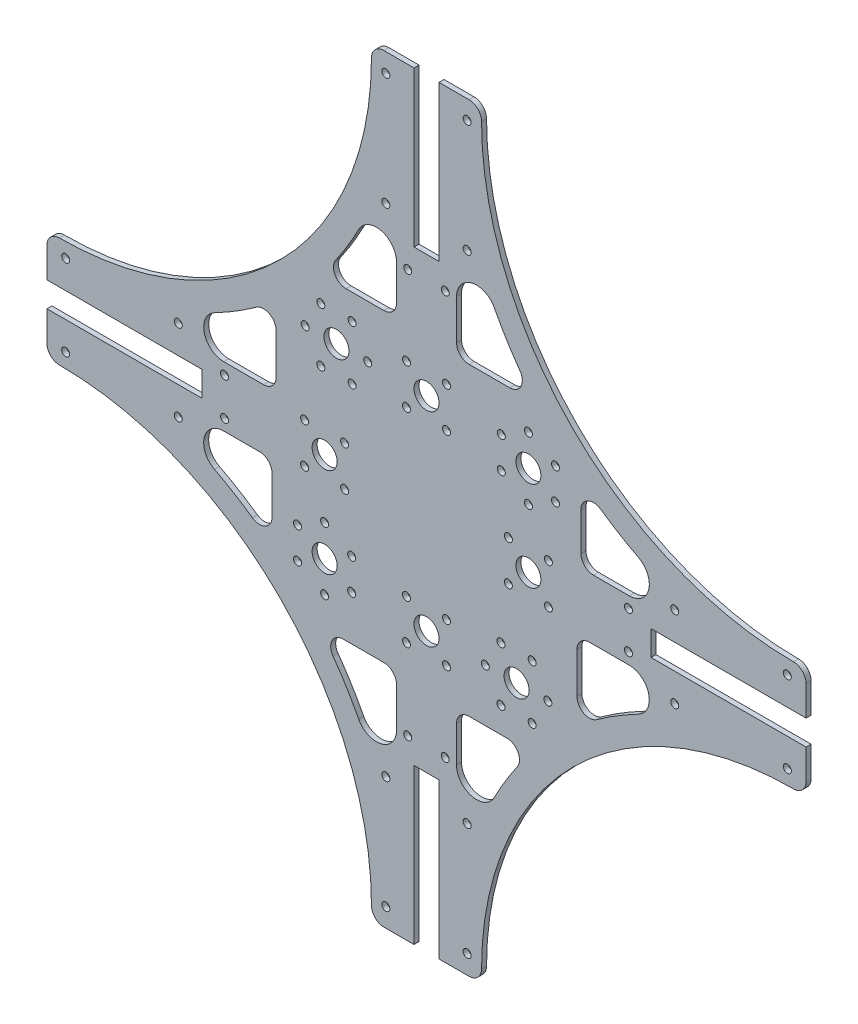
from build123d import *

# Parameters (mm, degrees)
BOSS_EXTRUDE1_DEPTH = 2
SKETCH2_R           = 5
CUT_EXTRUDE1_DEPTH  = 2
SKETCH3_R           = 5
SKETCH3_R_2         = 1.6
CUT_EXTRUDE2_DEPTH  = 2
SKETCH4_W           = 62
SKETCH4_H           = 10
CUT_EXTRUDE3_DEPTH  = 2
CIRPATTERN1_COUNT   = 4
BOSS_EXTRUDE2_DEPTH = 2
CIRPATTERN2_COUNT   = 4
SKETCH6_R           = 1.6
CUT_EXTRUDE4_DEPTH  = 2
CIRPATTERN3_COUNT   = 4
SKETCH7_R           = 1.6
CUT_EXTRUDE5_DEPTH  = 2
CIRPATTERN4_COUNT   = 4


with BuildPart() as part:
    # Sketch1 → Boss-Extrude1 (new body)
    with BuildSketch(Plane.XY):
        with BuildLine():
            Line((71.228993619, -85.582665129), (71.228993619, -51.582665129))
            ThreePointArc((71.228993619, -51.582665129), (69.764527525, -48.047131224), (66.228993619, -46.582665129))
            Line((66.228993619, -46.582665129), (-5.667209242, -46.582665129))
            ThreePointArc((-5.667209242, -46.582665129), (-25.346028045, -13.428336197), (-58.500356977, 6.250482606))
            Line((-58.500356977, 6.250482606), (-58.500356977, 78.146685467))
            ThreePointArc((-58.500356977, 78.146685467), (-59.964823071, 81.682219373), (-63.500356977, 83.146685467))
            Line((-63.500356977, 83.146685467), (-97.500356977, 83.146685467))
            ThreePointArc((-97.500356977, 83.146685467), (-101.035890883, 81.682219373), (-102.500356977, 78.146685467))
            Line((-102.500356977, 78.146685467), (-102.500356977, 6.250482606))
            ThreePointArc((-102.500356977, 6.250482606), (-135.65468591, -13.428336197), (-155.333504713, -46.582665129))
            Line((-155.333504713, -46.582665129), (-227.229707574, -46.582665129))
            ThreePointArc((-227.229707574, -46.582665129), (-230.76524148, -48.047131224), (-232.229707574, -51.582665129))
            Line((-232.229707574, -51.582665129), (-232.229707574, -85.582665129))
            ThreePointArc((-232.229707574, -85.582665129), (-230.76524148, -89.118199035), (-227.229707574, -90.582665129))
            Line((-227.229707574, -90.582665129), (-155.333504713, -90.582665129))
            ThreePointArc((-155.333504713, -90.582665129), (-135.65468591, -123.736994062), (-102.500356977, -143.415812865))
            Line((-102.500356977, -143.415812865), (-102.500356977, -215.312015726))
            ThreePointArc((-102.500356977, -215.312015726), (-101.035890883, -218.847549632), (-97.500356977, -220.312015726))
            Line((-97.500356977, -220.312015726), (-63.500356977, -220.312015726))
            ThreePointArc((-63.500356977, -220.312015726), (-59.964823071, -218.847549632), (-58.500356977, -215.312015726))
            Line((-58.500356977, -215.312015726), (-58.500356977, -143.415812865))
            ThreePointArc((-58.500356977, -143.415812865), (-25.346028045, -123.736994062), (-5.667209242, -90.582665129))
            Line((-5.667209242, -90.582665129), (66.228993619, -90.582665129))
            ThreePointArc((66.228993619, -90.582665129), (69.764527525, -89.118199035), (71.228993619, -85.582665129))
        make_face()
    extrude(amount=BOSS_EXTRUDE1_DEPTH)

    # Sketch2 → Cut-Extrude1 (cut)
    with BuildSketch(Plane.XY.offset(2)):
        with Locations((-39.771006381, -68.582665129)):
            Circle(SKETCH2_R)
        with Locations((-80.500356977, -109.312015726)):
            Circle(SKETCH2_R)
        with Locations((-121.229707574, -68.582665129)):
            Circle(SKETCH2_R)
        with Locations((-80.500356977, -27.853314533)):
            Circle(SKETCH2_R)
    extrude(amount=-CUT_EXTRUDE1_DEPTH, mode=Mode.SUBTRACT)

    # Sketch3 → Cut-Extrude2 (cut)
    with BuildSketch(Plane.XY.offset(2)):
        with Locations((-39.771006381, -32.582665129)):
            Circle(SKETCH3_R)
        with Locations((-39.771006381, -20.082665129)):
            Circle(SKETCH3_R_2)
        with Locations((-28.945688834, -26.332665129)):
            Circle(SKETCH3_R_2)
        with Locations((-28.945688834, -38.832665129)):
            Circle(SKETCH3_R_2)
        with Locations((-39.771006381, -45.082665129)):
            Circle(SKETCH3_R_2)
        with Locations((-50.596323928, -38.832665129)):
            Circle(SKETCH3_R_2)
        with Locations((-50.596323928, -26.332665129)):
            Circle(SKETCH3_R_2)
        with Locations((-44.500356977, -109.312015726)):
            Circle(SKETCH3_R)
        with Locations((-32.000356977, -109.312015726)):
            Circle(SKETCH3_R_2)
        with Locations((-38.250356977, -120.137333273)):
            Circle(SKETCH3_R_2)
        with Locations((-50.750356977, -120.137333273)):
            Circle(SKETCH3_R_2)
        with Locations((-57.000356977, -109.312015726)):
            Circle(SKETCH3_R_2)
        with Locations((-50.750356977, -98.486698178)):
            Circle(SKETCH3_R_2)
        with Locations((-38.250356977, -98.486698178)):
            Circle(SKETCH3_R_2)
        with Locations((-121.229707574, -104.582665129)):
            Circle(SKETCH3_R)
        with Locations((-121.229707574, -117.082665129)):
            Circle(SKETCH3_R_2)
        with Locations((-132.055025121, -110.832665129)):
            Circle(SKETCH3_R_2)
        with Locations((-132.055025121, -98.332665129)):
            Circle(SKETCH3_R_2)
        with Locations((-121.229707574, -92.082665129)):
            Circle(SKETCH3_R_2)
        with Locations((-110.404390026, -98.332665129)):
            Circle(SKETCH3_R_2)
        with Locations((-110.404390026, -110.832665129)):
            Circle(SKETCH3_R_2)
        with Locations((-116.500356977, -27.853314533)):
            Circle(SKETCH3_R)
        with Locations((-129.000356977, -27.853314533)):
            Circle(SKETCH3_R_2)
        with Locations((-122.750356977, -17.027996986)):
            Circle(SKETCH3_R_2)
        with Locations((-110.250356977, -17.027996986)):
            Circle(SKETCH3_R_2)
        with Locations((-104.000356977, -27.853314533)):
            Circle(SKETCH3_R_2)
        with Locations((-110.250356977, -38.67863208)):
            Circle(SKETCH3_R_2)
        with Locations((-122.750356977, -38.67863208)):
            Circle(SKETCH3_R_2)
    extrude(amount=-CUT_EXTRUDE2_DEPTH, mode=Mode.SUBTRACT)

    # Sketch4 → Cut-Extrude3 (cut)
    with BuildSketch(Plane(origin=(0, 0, 0), x_dir=(-1, 0, 0), z_dir=(0, 0, -1))):
        with Locations((201.229707574, -68.582665129)):
            Rectangle(SKETCH4_W, SKETCH4_H)
    cut_extrude3 = extrude(amount=-CUT_EXTRUDE3_DEPTH, mode=Mode.SUBTRACT)

    # CirPattern1: Cut-Extrude3 ×4 about axis
    cirpattern1_axis = Axis((-80.500356977, -68.582665129, 62.481201405), (0, 0, -1))
    for i in range(1, CIRPATTERN1_COUNT):
        add(cut_extrude3.rotate(cirpattern1_axis, i * 360 / CIRPATTERN1_COUNT), mode=Mode.SUBTRACT)

    # Sketch5 → Boss-Extrude2 (add)
    with BuildSketch(Plane.XY.offset(2)):
        with BuildLine():
            Line((66.228993619, -46.582665129), (-5.667209242, -46.582665129))
            Line((-5.667209242, -46.582665129), (-58.500356977, 6.250482606))
            Line((-58.500356977, 6.250482606), (-58.500356977, 78.146685467))
            ThreePointArc((-58.500356977, 78.146685467), (-21.967976001, -10.050284153), (66.228993619, -46.582665129))
        make_face()
    boss_extrude2 = extrude(amount=-BOSS_EXTRUDE2_DEPTH)

    # CirPattern2: Boss-Extrude2 ×4 about axis
    cirpattern2_axis = Axis((-80.500356977, -68.582665129, 62.481201405), (0, 0, -1))
    for i in range(1, CIRPATTERN2_COUNT):
        add(boss_extrude2.rotate(cirpattern2_axis, i * 360 / CIRPATTERN2_COUNT))

    # Sketch6 → Cut-Extrude4 (cut)
    with BuildSketch(Plane.XY.offset(2)):
        with Locations((-72.500356977, -19.853314533)):
            Circle(SKETCH6_R)
        with Locations((-72.500356977, -35.853314533)):
            Circle(SKETCH6_R)
        with Locations((-88.500356977, -35.853314533)):
            Circle(SKETCH6_R)
        with Locations((-88.500356977, -19.853314533)):
            Circle(SKETCH6_R)
        with BuildLine():
            Line((0.568204566, -56.582665129), (-13.771006381, -56.582665129))
            ThreePointArc((-13.771006381, -56.582665129), (-17.306540287, -55.118199035), (-18.771006381, -51.582665129))
            Line((-18.771006381, -51.582665129), (-18.771006381, -36.41461436))
            ThreePointArc((-18.771006381, -36.41461436), (-16.082565913, -31.98102749), (-10.908329368, -32.315214365))
            ThreePointArc((-10.908329368, -32.315214365), (-3.480672438, -37.146681083), (4.248500947, -41.47946736))
            ThreePointArc((4.248500947, -41.47946736), (8.340771135, -50.476657981), (0.568204566, -56.582665129))
        make_face()
        with BuildLine():
            Line((-68.490992753, -3.441767926), (-68.490992753, 12.46782604))
            ThreePointArc((-68.490992753, 12.46782604), (-62.385539766, 20.240257552), (-53.388319849, 16.149135267))
            ThreePointArc((-53.388319849, 16.149135267), (-48.570892, 7.627296828), (-43.147404283, -0.52225055))
            ThreePointArc((-43.147404283, -0.52225055), (-42.756936227, -5.722383317), (-47.20651974, -8.441767926))
            Line((-47.20651974, -8.441767926), (-63.490992753, -8.441767926))
            ThreePointArc((-63.490992753, -8.441767926), (-67.026526658, -6.977301832), (-68.490992753, -3.441767926))
        make_face()
    cut_extrude4 = extrude(amount=-CUT_EXTRUDE4_DEPTH, mode=Mode.SUBTRACT)

    # CirPattern3: Cut-Extrude4 ×4 about axis
    cirpattern3_axis = Axis((-80.500356977, -68.582665129, 62.481201405), (0, 0, -1))
    for i in range(1, CIRPATTERN3_COUNT):
        add(cut_extrude4.rotate(cirpattern3_axis, i * 360 / CIRPATTERN3_COUNT), mode=Mode.SUBTRACT)

    # Sketch7 → Cut-Extrude5 (cut)
    with BuildSketch(Plane.XY.offset(2)):
        with Locations((0.228993619, -76.092029354)):
            Circle(SKETCH7_R)
        with Locations((0.228993619, -61.092029354)):
            Circle(SKETCH7_R)
        with Locations((63.728993619, -84.83266513)):
            Circle(SKETCH7_R)
        with Locations((63.728993619, -52.33266513)):
            Circle(SKETCH7_R)
        with Locations((18.728993619, -84.83266513)):
            Circle(SKETCH7_R)
        with Locations((18.728993619, -52.33266513)):
            Circle(SKETCH7_R)
    cut_extrude5 = extrude(amount=-CUT_EXTRUDE5_DEPTH, mode=Mode.SUBTRACT)

    # CirPattern4: Cut-Extrude5 ×4 about axis
    cirpattern4_axis = Axis((-80.500356977, -68.582665129, 62.481201405), (0, 0, -1))
    for i in range(1, CIRPATTERN4_COUNT):
        add(cut_extrude5.rotate(cirpattern4_axis, i * 360 / CIRPATTERN4_COUNT), mode=Mode.SUBTRACT)


solid = part.part
